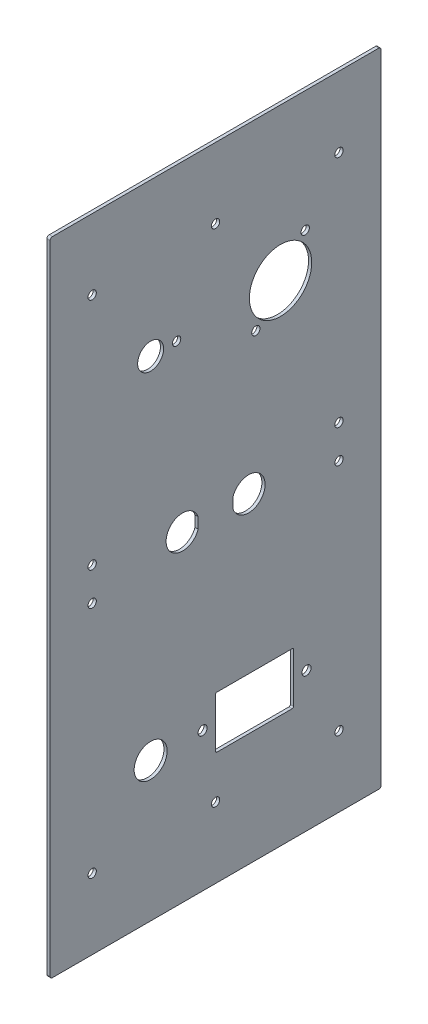
from build123d import *

# Parameters (mm, degrees)
BOSS_EXTRUDE1_DEPTH = 1.22
SKETCH3_R           = 1.6
CUT_EXTRUDE1_DEPTH  = 246.803551555
SKETCH4_R           = 12
SKETCH4_R_2         = 5
SKETCH4_R_3         = 1.75
SKETCH4_R_4         = 1.6
SKETCH4_R_5         = 6.35
CUT_EXTRUDE2_DEPTH  = 246.803551555


with BuildPart() as part:
    # Sketch1 → Boss-Extrude1 (new body)
    with BuildSketch(Plane(origin=(0, 0, 0), x_dir=(0, 0, -1), z_dir=(1, 0, 0))):
        with BuildLine():
            Line((62.8, 9.646), (-62.8, 9.646))
            ThreePointArc((-62.8, 9.646), (-63.428617928, 9.385617928), (-63.689, 8.757))
            Line((-63.689, 8.757), (-63.689, -236.517))
            ThreePointArc((-63.689, -236.517), (-63.428617928, -237.145617928), (-62.8, -237.406))
            Line((-62.8, -237.406), (62.8, -237.406))
            ThreePointArc((62.8, -237.406), (63.428617928, -237.145617928), (63.689, -236.517))
            Line((63.689, -236.517), (63.689, 8.757))
            ThreePointArc((63.689, 8.757), (63.428617928, 9.385617928), (62.8, 9.646))
        make_face()
    extrude(amount=-BOSS_EXTRUDE1_DEPTH)

    # Sketch3 → Cut-Extrude1 (cut, through all)
    with BuildSketch(Plane(origin=(0, 0, 0), x_dir=(0, 0, -1), z_dir=(1, 0, 0))):
        with Locations((47.5, -107.5)):
            Circle(SKETCH3_R)
        with Locations((-47.5, -107.5)):
            Circle(SKETCH3_R)
        with Locations((47.5, -17.5)):
            Circle(SKETCH3_R)
        with Locations((0, -17.5)):
            Circle(SKETCH3_R)
        with Locations((-47.5, -17.5)):
            Circle(SKETCH3_R)
        with Locations((-47.5, -210.26)):
            Circle(SKETCH3_R)
        with Locations((0, -210.26)):
            Circle(SKETCH3_R)
        with Locations((47.5, -210.26)):
            Circle(SKETCH3_R)
        with Locations((-47.5, -120.26)):
            Circle(SKETCH3_R)
        with Locations((47.5, -120.26)):
            Circle(SKETCH3_R)
    extrude(amount=-CUT_EXTRUDE1_DEPTH, mode=Mode.SUBTRACT)

    # Sketch4 → Cut-Extrude2 (cut, through all)
    with BuildSketch(Plane(origin=(0, 0, 0), x_dir=(0, 0, -1), z_dir=(1, 0, 0))):
        with Locations((25, -48.88)):
            Circle(SKETCH4_R)
        with Locations((-25, -49.13)):
            Circle(SKETCH4_R_2)
        with Locations((35, -183.88)):
            Circle(SKETCH4_R_3)
        with Locations((-5, -183.88)):
            Circle(SKETCH4_R_3)
        with Locations((34.5, -36.88)):
            Circle(SKETCH4_R_4)
        with Locations((15.5, -60.88)):
            Circle(SKETCH4_R_4)
        with Locations((-15, -49.13)):
            Circle(SKETCH4_R_4)
        with Locations((-25, -183.88)):
            Circle(SKETCH4_R_5)
        with BuildLine():
            Line((0.5, -193.88), (29.5, -193.88))
            ThreePointArc((29.5, -193.88), (29.853553391, -193.733553391), (30, -193.38))
            Line((30, -193.38), (30, -174.38))
            ThreePointArc((30, -174.38), (29.853553391, -174.026446609), (29.5, -173.88))
            Line((29.5, -173.88), (0.5, -173.88))
            ThreePointArc((0.5, -173.88), (0.146446609, -174.026446609), (0, -174.38))
            Line((0, -174.38), (0, -193.38))
            ThreePointArc((0, -193.38), (0.146446609, -193.733553391), (0.5, -193.88))
        make_face()
        with BuildLine():
            Line((6.7, -111.800937711), (6.7, -115.959062289))
            ThreePointArc((6.7, -115.959062289), (19.05, -113.88), (6.7, -111.800937711))
        make_face()
        with BuildLine():
            Line((-6.7, -111.800937711), (-6.7, -115.959062289))
            ThreePointArc((-6.7, -115.959062289), (-19.05, -113.88), (-6.7, -111.800937711))
        make_face()
    extrude(amount=-CUT_EXTRUDE2_DEPTH, mode=Mode.SUBTRACT)


solid = part.part
